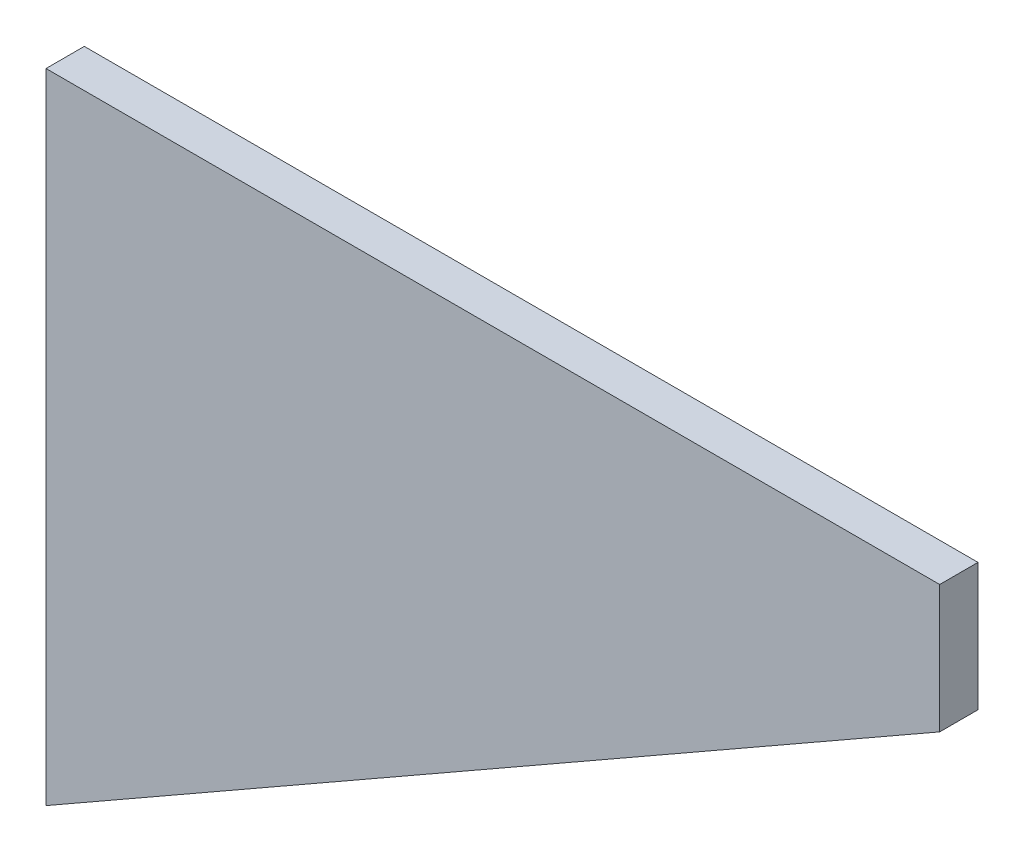
from build123d import *

# Parameters (mm, degrees)
EXTRUDE_1_DEPTH = 6


with BuildPart() as part:
    # 草图1 → 凸台-拉伸1 (new body)
    with BuildSketch(Plane.XY):
        Polygon((0, 0), (0, 100), (140, 100), (140, 80), align=None)
    extrude(amount=EXTRUDE_1_DEPTH)


solid = part.part
